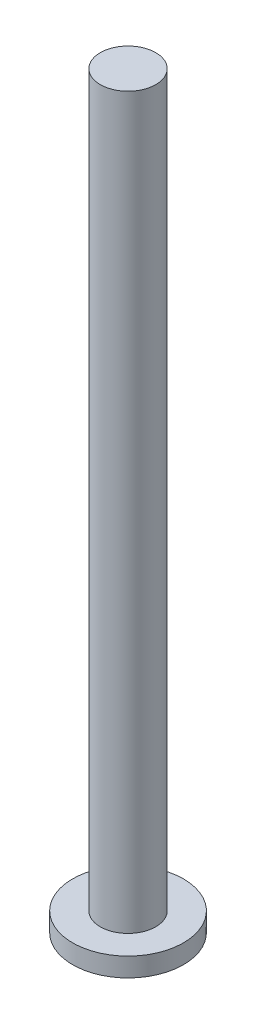
from build123d import *

# Parameters (mm, degrees)
SKETCH1_R           = 9.652
BOSS_EXTRUDE1_DEPTH = 3.302
SKETCH1_4_R         = 4.826
BOSS_EXTRUDE2_DEPTH = 130.302
SKETCH1_6_R         = 3.302
CUT_EXTRUDE1_DEPTH  = 127


with BuildPart() as part:
    # Sketch1 → Boss-Extrude1 (new body)
    with BuildSketch(Plane(origin=(0, 0, 0), x_dir=(1, 0, 0), z_dir=(0, 1, 0))):
        Circle(SKETCH1_R)
    extrude(amount=BOSS_EXTRUDE1_DEPTH)

    # Sketch1<4> → Boss-Extrude2 (add)
    with BuildSketch(Plane(origin=(0, 0, 0), x_dir=(1, 0, 0), z_dir=(0, 1, 0))):
        Circle(SKETCH1_4_R)
    extrude(amount=BOSS_EXTRUDE2_DEPTH)

    # Sketch1<6> → Cut-Extrude1 (cut)
    with BuildSketch(Plane(origin=(0, 0, 0), x_dir=(1, 0, 0), z_dir=(0, 1, 0))):
        Circle(SKETCH1_6_R)
    extrude(amount=CUT_EXTRUDE1_DEPTH, mode=Mode.SUBTRACT)


solid = part.part
